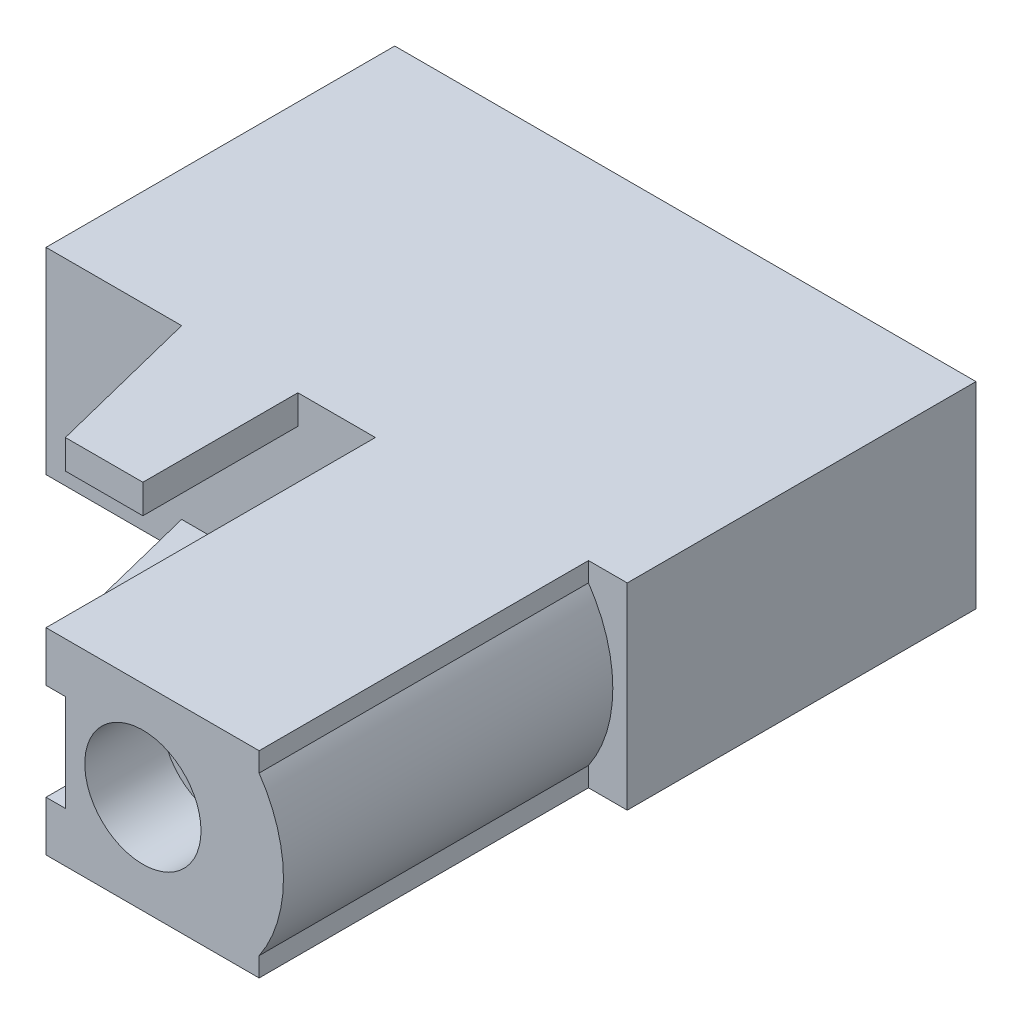
from build123d import *

# Parameters (mm, degrees)
SKETCH_1_W          = 15
SKETCH_1_H          = 5.08
EXTRUDE_1_DEPTH     = 9
SKETCH_2_R          = 0.75
EXTRUDE_2_DEPTH     = 8.5
SKETCH_3_R          = 1.5
CUT_EXTRUDE_1_DEPTH = 2
EXTRUDE_3_DEPTH     = 0.75


with BuildPart() as part:
    # 草图1 → 凸台-拉伸1 (new body)
    with BuildSketch(Plane.XY):
        Rectangle(SKETCH_1_W, SKETCH_1_H)
    extrude(amount=EXTRUDE_1_DEPTH)

    # 草图2 → 凸台-拉伸2 (add)
    with BuildSketch(Plane.XY.offset(9)):
        with BuildLine():
            Line((6.5, -2.54), (6.5, -2.04))
            ThreePointArc((6.5, -2.04), (7.12789195, 0), (6.5, 2.04))
            Line((6.5, 2.04), (6.5, 2.54))
            Line((6.5, 2.54), (1, 2.54))
            Line((1, 2.54), (1, 1.25))
            Line((1, 1.25), (1.5, 1.25))
            Line((1.5, 1.25), (1.5, -1.25))
            Line((1.5, -1.25), (1, -1.25))
            Line((1, -1.25), (1, -2.54))
            Line((1, -2.54), (6.5, -2.54))
        make_face()
        with Locations((3.5, 0)):
            Circle(SKETCH_2_R, mode=Mode.SUBTRACT)
    extrude(amount=EXTRUDE_2_DEPTH)

    # 草图3 → 切除-拉伸1 (cut)
    with BuildSketch(Plane.XY.offset(17.5)):
        with Locations((3.5, 0)):
            Circle(SKETCH_3_R)
    extrude(amount=-CUT_EXTRUDE_1_DEPTH, mode=Mode.SUBTRACT)

    # 草图4 → 凸台-拉伸3 (add)
    with BuildSketch(Plane.XZ.offset(2.54)):
        Polygon((-4, 9), (-4, 8.307126737), (-1, 8.307126737), (-1, 9), (-1, 13), (-3, 13), align=None)
    extrude_3 = extrude(amount=-EXTRUDE_3_DEPTH)

    # 镜向1: 凸台-拉伸3 across plane
    add(extrude_3.mirror(Plane.ZX))


solid = part.part
